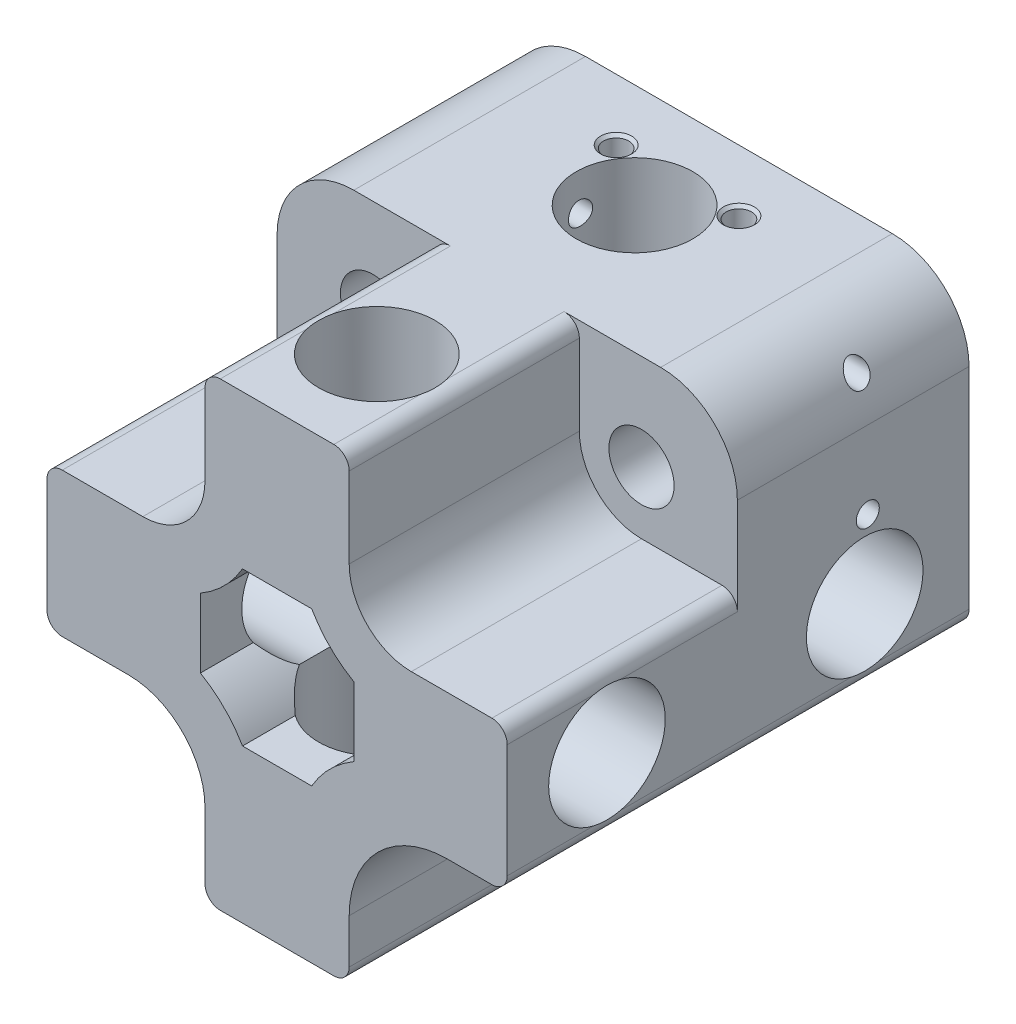
from build123d import *

# Parameters (mm, degrees)
SCHIZZO1_W                          = 60
SCHIZZO1_H                          = 60
ESTRUSIONE_ESTRUSIONE1_DEPTH        = 60.2
SCHIZZO2_R                          = 7.6
TAGLIO_ESTRUSIONE1_DEPTH            = 105.038646666
SCHIZZO3_R                          = 7.6
TAGLIO_ESTRUSIONE2_DEPTH            = 105.038646666
SCHIZZO4_R                          = 8.1
TAGLIO_ESTRUSIONE3_DEPTH            = 105.038646666
TAGLIO_ESTRUSIONE4_DEPTH            = 105.038646666
RACCORDO1_R                         = 10
TAGLIO_ESTRUSIONE5_DEPTH            = 30
SCHIZZO10_R                         = 8.1
ESTRUSIONE_ESTRUSIONE3_DEPTH        = 10
SCHIZZO13_R                         = 4.25
TAGLIO_ESTRUSIONE6_DEPTH            = 9.8
TAGLIO_ESTRUSIONE7_DEPTH            = 30
TAGLIO_ESTRUSIONE7_DEPTH_BACK       = 30.2
ESTRUSIONE_ESTRUSIONE4_DEPTH        = 60.2
FORO_2_6_2_6_2_D                    = 2.6
FORO_2_6_2_6_2_DEPTH                = 10
FORO_2_6_2_6_2_TIP                  = 0.781118805
SCHIZZO20_R                         = 1.5
TAGLIO_ESTRUSIONE8_DEPTH            = 71
SCHIZZO22_R                         = 1.5
TAGLIO_ESTRUSIONE9_DEPTH            = 71
FORO_FILETTATO_M4X0_7_1_D           = 3.3
FORO_FILETTATO_M4X0_7_1_DEPTH       = 11.5
FORO_FILETTATO_M4X0_7_1_CSINK_D     = 4.05
FORO_FILETTATO_M4X0_7_1_CSINK_ANGLE = 90
FORO_FILETTATO_M4X0_7_1_TIP         = 0.991420021


with BuildPart() as part:
    # Schizzo1 → Estrusione-Estrusione1 (new body)
    with BuildSketch(Plane.XY):
        with Locations((-30, 30)):
            Rectangle(SCHIZZO1_W, SCHIZZO1_H)
    extrude(amount=ESTRUSIONE_ESTRUSIONE1_DEPTH)

    # Schizzo2 → Taglio-Estrusione1 (cut, through all)
    with BuildSketch(Plane(origin=(0, 0, 0), x_dir=(0, 0, -1), z_dir=(1, 0, 0))):
        with Locations((-13.6, 30)):
            Circle(SCHIZZO2_R)
        with Locations((-47.2, 30)):
            Circle(SCHIZZO2_R)
    extrude(amount=-TAGLIO_ESTRUSIONE1_DEPTH, mode=Mode.SUBTRACT)

    # Schizzo3 → Taglio-Estrusione2 (cut, through all)
    with BuildSketch(Plane(origin=(0, 60, 0), x_dir=(0, 0, -1), z_dir=(0, 1, 0))):
        with Locations(Location((-47.2, 30, 0), (0, 0, 180))):
            Circle(SCHIZZO3_R)
        with Locations(Location((-13.6, 30, 0), (0, 0, 180))):
            Circle(SCHIZZO3_R)
    extrude(amount=-TAGLIO_ESTRUSIONE2_DEPTH, mode=Mode.SUBTRACT)

    # Schizzo4 → Taglio-Estrusione3 (cut, through all)
    with BuildSketch(Plane.XY.offset(60.2)):
        with Locations((-12.5, 12.5)):
            Circle(SCHIZZO4_R)
        with Locations((-47.5, 12.5)):
            Circle(SCHIZZO4_R)
        with Locations((-47.5, 47.5)):
            Circle(SCHIZZO4_R)
        with Locations((-12.5, 47.5)):
            Circle(SCHIZZO4_R)
    extrude(amount=-TAGLIO_ESTRUSIONE3_DEPTH, mode=Mode.SUBTRACT)

    # Schizzo7 → Taglio-Estrusione4 (cut, through all)
    with BuildSketch(Plane.XY.offset(60.2)):
        with BuildLine():
            Line((-20, 34.509618943), (-20, 25.490381057))
            ThreePointArc((-20, 25.490381057), (-23.106601718, 23.106601718), (-25.490381057, 20))
            Line((-25.490381057, 20), (-34.509618943, 20))
            ThreePointArc((-34.509618943, 20), (-36.893398282, 23.106601718), (-40, 25.490381057))
            Line((-40, 25.490381057), (-40, 34.509618943))
            ThreePointArc((-40, 34.509618943), (-36.893398282, 36.893398282), (-34.509618943, 40))
            Line((-34.509618943, 40), (-25.490381057, 40))
            ThreePointArc((-25.490381057, 40), (-23.106601718, 36.893398282), (-20, 34.509618943))
        make_face()
    extrude(amount=-TAGLIO_ESTRUSIONE4_DEPTH, mode=Mode.SUBTRACT)

    # Raccordo1
    raccordo1_edges = [part.edges().sort_by_distance(p)[0] for p in [
        (-60, 0, 30.1),
        (-60, 60, 30.1),
        (0, 60, 30.1),
        (0, 0, 30.1),
    ]]
    fillet(raccordo1_edges, radius=RACCORDO1_R)

    # Schizzo8 → Taglio-Estrusione5 (cut)
    with BuildSketch(Plane.XY.offset(60.2)):
        with BuildLine():
            Line((-47.5, 20.6), (-58, 20.6))
            ThreePointArc((-58, 20.6), (-59.414213562, 21.185786438), (-60, 22.6))
            Line((-60, 22.6), (-60, 10))
            ThreePointArc((-60, 10), (-57.071067812, 2.928932188), (-50, 0))
            Line((-50, 0), (-37.4, 0))
            ThreePointArc((-37.4, 0), (-38.814213562, 0.585786438), (-39.4, 2))
            Line((-39.4, 2), (-39.4, 12.5))
            ThreePointArc((-39.4, 12.5), (-41.772435072, 18.227564928), (-47.5, 20.6))
        make_face()
        with BuildLine():
            Line((-39.4, 47.5), (-39.4, 58))
            ThreePointArc((-39.4, 58), (-38.814213562, 59.414213562), (-37.4, 60))
            Line((-37.4, 60), (-50, 60))
            ThreePointArc((-50, 60), (-57.071067812, 57.071067812), (-60, 50))
            Line((-60, 50), (-60, 37.4))
            ThreePointArc((-60, 37.4), (-59.414213562, 38.814213562), (-58, 39.4))
            Line((-58, 39.4), (-47.5, 39.4))
            ThreePointArc((-47.5, 39.4), (-41.772435072, 41.772435072), (-39.4, 47.5))
        make_face()
        with BuildLine():
            Line((-12.5, 39.4), (-2, 39.4))
            ThreePointArc((-2, 39.4), (-0.585786438, 38.814213562), (0, 37.4))
            Line((0, 37.4), (0, 50))
            ThreePointArc((0, 50), (-2.928932188, 57.071067812), (-10, 60))
            Line((-10, 60), (-22.6, 60))
            ThreePointArc((-22.6, 60), (-21.185786438, 59.414213562), (-20.6, 58))
            Line((-20.6, 58), (-20.6, 47.5))
            ThreePointArc((-20.6, 47.5), (-18.227564928, 41.772435072), (-12.5, 39.4))
        make_face()
        with BuildLine():
            Line((-20.6, 12.5), (-20.6, 2))
            ThreePointArc((-20.6, 2), (-21.185786438, 0.585786438), (-22.6, 0))
            Line((-22.6, 0), (-10, 0))
            ThreePointArc((-10, 0), (-2.928932188, 2.928932188), (0, 10))
            Line((0, 10), (0, 22.6))
            ThreePointArc((0, 22.6), (-0.585786438, 21.185786438), (-2, 20.6))
            Line((-2, 20.6), (-12.5, 20.6))
            ThreePointArc((-12.5, 20.6), (-18.227564928, 18.227564928), (-20.6, 12.5))
        make_face()
    extrude(amount=-TAGLIO_ESTRUSIONE5_DEPTH, mode=Mode.SUBTRACT)

    # Schizzo10 → Estrusione-Estrusione3 (add)
    with BuildSketch(Plane.XY.offset(30.2)):
        with Locations((-47.5, 47.5)):
            Circle(SCHIZZO10_R)
        with Locations((-12.5, 47.5)):
            Circle(SCHIZZO10_R)
    extrude(amount=-ESTRUSIONE_ESTRUSIONE3_DEPTH)

    # Schizzo13 → Taglio-Estrusione6 (cut)
    with BuildSketch(Plane.XY.offset(30.2)):
        with Locations((-12.5, 47.5)):
            Circle(SCHIZZO13_R)
        with Locations((-47.5, 47.5)):
            Circle(SCHIZZO13_R)
    extrude(amount=-TAGLIO_ESTRUSIONE6_DEPTH, mode=Mode.SUBTRACT)

    # Schizzo14 → Taglio-Estrusione7 (cut, two sides: drawn at the far end of the back side and taken through both)
    with BuildSketch(Plane.XY.offset(30.2).offset(-TAGLIO_ESTRUSIONE7_DEPTH_BACK)):
        with BuildLine():
            ThreePointArc((-39.4, 12.5), (-53.227564928, 6.772435072), (-47.5, 20.6))
            Line((-47.5, 20.6), (-58, 20.6))
            ThreePointArc((-58, 20.6), (-59.414213562, 21.185786438), (-60, 22.6))
            Line((-60, 22.6), (-60, 10))
            ThreePointArc((-60, 10), (-57.071067812, 2.928932188), (-50, 0))
            Line((-50, 0), (-37.4, 0))
            ThreePointArc((-37.4, 0), (-38.814213562, 0.585786438), (-39.4, 2))
            Line((-39.4, 2), (-39.4, 12.5))
        make_face()
        with BuildLine():
            ThreePointArc((-39.4, 12.5), (-41.772435072, 18.227564928), (-47.5, 20.6))
            ThreePointArc((-47.5, 20.6), (-53.227564928, 6.772435072), (-39.4, 12.5))
        make_face()
        with BuildLine():
            ThreePointArc((-12.5, 20.6), (-18.227564928, 18.227564928), (-20.6, 12.5))
            Line((-20.6, 12.5), (-20.6, 2))
            ThreePointArc((-20.6, 2), (-21.185786438, 0.585786438), (-22.6, 0))
            Line((-22.6, 0), (-10, 0))
            ThreePointArc((-10, 0), (-2.928932188, 2.928932188), (0, 10))
            Line((0, 10), (0, 22.6))
            ThreePointArc((0, 22.6), (-0.585786438, 21.185786438), (-2, 20.6))
            Line((-2, 20.6), (-12.5, 20.6))
        make_face()
    extrude(amount=TAGLIO_ESTRUSIONE7_DEPTH + TAGLIO_ESTRUSIONE7_DEPTH_BACK, mode=Mode.SUBTRACT)

    # Schizzo15 → Estrusione-Estrusione4 (add, through all)
    with BuildSketch(Plane.XY.offset(60.2)):
        with BuildLine():
            Line((-20.6, 12.5), (-20.6, 7.8))
            ThreePointArc((-20.6, 7.8), (-16.850966799, 16.850966799), (-7.8, 20.6))
            Line((-7.8, 20.6), (-12.5, 20.6))
            ThreePointArc((-12.5, 20.6), (-18.227564928, 18.227564928), (-20.6, 12.5))
        make_face()
        with BuildLine():
            Line((-49.4, 20.6), (-47.5, 20.6))
            ThreePointArc((-47.5, 20.6), (-41.772435072, 18.227564928), (-39.4, 12.5))
            Line((-39.4, 12.5), (-39.4, 10.6))
            ThreePointArc((-39.4, 10.6), (-42.328932188, 17.671067812), (-49.4, 20.6))
        make_face()
    extrude(amount=-ESTRUSIONE_ESTRUSIONE4_DEPTH)

    # Foro Ø2.6 (2.6)-2
    with Locations(Plane(origin=(0, 0, 0), x_dir=(-1, 0, 0), z_dir=(0, 0, -1))):
        with Locations((24.1, 16.1), (16.1, 24.1), (35.9, 16.1), (43.9, 24.1)):
            Hole(FORO_2_6_2_6_2_D / 2, depth=FORO_2_6_2_6_2_DEPTH)
            with Locations((0, 0, -(FORO_2_6_2_6_2_DEPTH + FORO_2_6_2_6_2_TIP / 2))):  # 118° drill point
                Cone(0, FORO_2_6_2_6_2_D / 2, FORO_2_6_2_6_2_TIP, mode=Mode.SUBTRACT)

    # Schizzo20 → Taglio-Estrusione8 (cut)
    with BuildSketch(Plane(origin=(0, 0, 0), x_dir=(0, 0, -1), z_dir=(1, 0, 0))):
        with Locations((-13.2, 39.9)):
            Circle(SCHIZZO20_R)
    extrude(amount=-TAGLIO_ESTRUSIONE8_DEPTH, mode=Mode.SUBTRACT)

    # Schizzo22 → Taglio-Estrusione9 (cut)
    with BuildSketch(Plane(origin=(0, 0, 0), x_dir=(0, 0, -1), z_dir=(1, 0, 0))):
        with Locations((-13.2, 55.1)):
            Circle(SCHIZZO22_R)
    extrude(amount=-TAGLIO_ESTRUSIONE9_DEPTH, mode=Mode.SUBTRACT)

    # Foro filettato M4x0.7-1
    with Locations(Plane(origin=(0, 60, 0), x_dir=(1, 0, 0), z_dir=(0, 1, 0))):
        with Locations((-38, -8), (-22, -8)):
            CounterSinkHole(FORO_FILETTATO_M4X0_7_1_D / 2, FORO_FILETTATO_M4X0_7_1_CSINK_D / 2, depth=FORO_FILETTATO_M4X0_7_1_DEPTH, counter_sink_angle=FORO_FILETTATO_M4X0_7_1_CSINK_ANGLE)
            with Locations((0, 0, -(FORO_FILETTATO_M4X0_7_1_DEPTH + FORO_FILETTATO_M4X0_7_1_TIP / 2))):  # 118° drill point
                Cone(0, FORO_FILETTATO_M4X0_7_1_D / 2, FORO_FILETTATO_M4X0_7_1_TIP, mode=Mode.SUBTRACT)


solid = part.part
